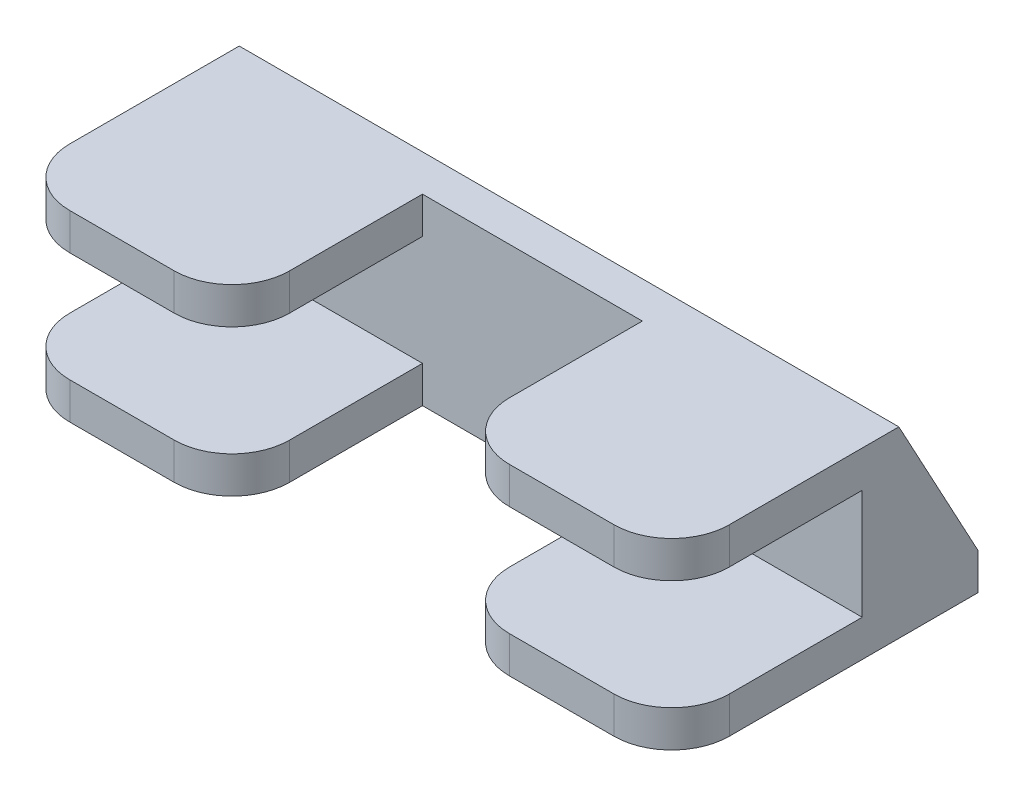
from build123d import *

# Parameters (mm, degrees)
SKETCH1_W           = 114.3
SKETCH1_H           = 19.05
BOSS_EXTRUDE1_DEPTH = 6.35
SKETCH3_W           = 38.1
SKETCH3_H           = 33.02
SKETCH3_W_2         = 114.3
SKETCH3_H_2         = 13.716
SKETCH3_H_3         = 6.35
BOSS_EXTRUDE2_DEPTH = 6.35
SKETCH4_W           = 38.1
SKETCH4_H           = 33.02
BOSS_EXTRUDE3_DEPTH = 6.35
SKETCH6_W           = 38.1
SKETCH6_H           = 13.716
CUT_EXTRUDE1_DEPTH  = 74.900469552
BOSS_EXTRUDE4_DEPTH = 6.35
BOSS_EXTRUDE5_DEPTH = 6.35
BOSS_EXTRUDE6_DEPTH = 6.35
BOSS_EXTRUDE7_DEPTH = 6.35
SKETCH10_R          = 2.286
CUT_EXTRUDE2_DEPTH  = 74.900469552
FILLET2_R           = 10


with BuildPart() as part:
    # Sketch1 → Boss-Extrude1 (new body)
    with BuildSketch(Plane.XY):
        Rectangle(SKETCH1_W, SKETCH1_H)
    extrude(amount=BOSS_EXTRUDE1_DEPTH)

    # Sketch3 → Boss-Extrude2 (add)
    with BuildSketch(Plane(origin=(0, -9.525, 0), x_dir=(-1, 0, 0), z_dir=(0, -1, 0))):
        with Locations((38.1, -22.86)):
            Rectangle(SKETCH3_W, SKETCH3_H)
        with Locations((0, 6.858)):
            Rectangle(SKETCH3_W_2, SKETCH3_H_2)
        with Locations((0, -3.175)):
            Rectangle(SKETCH3_W_2, SKETCH3_H_3)
        with Locations((-38.1, -22.86)):
            Rectangle(SKETCH3_W, SKETCH3_H)
    extrude(amount=BOSS_EXTRUDE2_DEPTH)

    # Sketch4 → Boss-Extrude3 (add)
    with BuildSketch(Plane(origin=(0, 9.525, 0), x_dir=(1, 0, 0), z_dir=(0, 1, 0))):
        with Locations((38.1, -22.86)):
            Rectangle(SKETCH4_W, SKETCH4_H)
        Polygon((57.15, -6.35), (57.15, 0), (-57.15, 0), (-57.15, -6.35), (-19.05, -6.35), (19.05, -6.35), align=None)
        with Locations((-38.1, -22.86)):
            Rectangle(SKETCH4_W, SKETCH4_H)
    extrude(amount=BOSS_EXTRUDE3_DEPTH)

    # Sketch6 → Cut-Extrude1 (cut, through all)
    with BuildSketch(Plane(origin=(0, -9.525, 0), x_dir=(1, 0, 0), z_dir=(0, 1, 0))):
        with Locations((0, 6.858)):
            Rectangle(SKETCH6_W, SKETCH6_H)
    extrude(amount=-CUT_EXTRUDE1_DEPTH, mode=Mode.SUBTRACT)

    # Sketch5 → Boss-Extrude4 (add)
    with BuildSketch(Plane(origin=(57.15, 0, 0), x_dir=(0, 0, -1), z_dir=(1, 0, 0))):
        Polygon((13.716, -9.525), (0, 15.875), (0, -9.525), align=None)
    extrude(amount=-BOSS_EXTRUDE4_DEPTH)

    # Sketch7 → Boss-Extrude5 (add)
    with BuildSketch(Plane.ZY.offset(-19.05)):
        Polygon((-13.716, -9.525), (0, -9.525), (0, 15.875), align=None)
    extrude(amount=-BOSS_EXTRUDE5_DEPTH)

    # Sketch8 → Boss-Extrude6 (add)
    with BuildSketch(Plane(origin=(-19.05, 0, 0), x_dir=(0, 0, -1), z_dir=(1, 0, 0))):
        Polygon((13.716, -9.525), (0, 15.875), (0, -9.525), align=None)
    extrude(amount=-BOSS_EXTRUDE6_DEPTH)

    # Sketch9 → Boss-Extrude7 (add)
    with BuildSketch(Plane.ZY.offset(57.15)):
        Polygon((-13.716, -9.525), (0, -9.525), (0, 15.875), align=None)
    extrude(amount=-BOSS_EXTRUDE7_DEPTH)

    # Sketch10 → Cut-Extrude2 (cut, through all)
    with BuildSketch(Plane(origin=(0, -9.525, 0), x_dir=(1, 0, 0), z_dir=(0, 1, 0))):
        with Locations(Location((38.1, 6.858, 0), (0, 0, 270))):
            Circle(SKETCH10_R)
        with Locations(Location((-38.1, 6.858, 0), (0, 0, 270))):
            Circle(SKETCH10_R)
    extrude(amount=-CUT_EXTRUDE2_DEPTH, mode=Mode.SUBTRACT)

    # Fillet2
    fillet2_edges = [part.edges().sort_by_distance(p)[0] for p in [
        (-19.05, -12.7, 39.37),
        (-57.15, -12.7, 39.37),
        (57.15, -12.7, 39.37),
        (19.05, -12.7, 39.37),
        (19.05, 12.7, 39.37),
        (57.15, 12.7, 39.37),
        (-57.15, 12.7, 39.37),
        (-19.05, 12.7, 39.37),
    ]]
    fillet(fillet2_edges, radius=FILLET2_R)


solid = part.part
